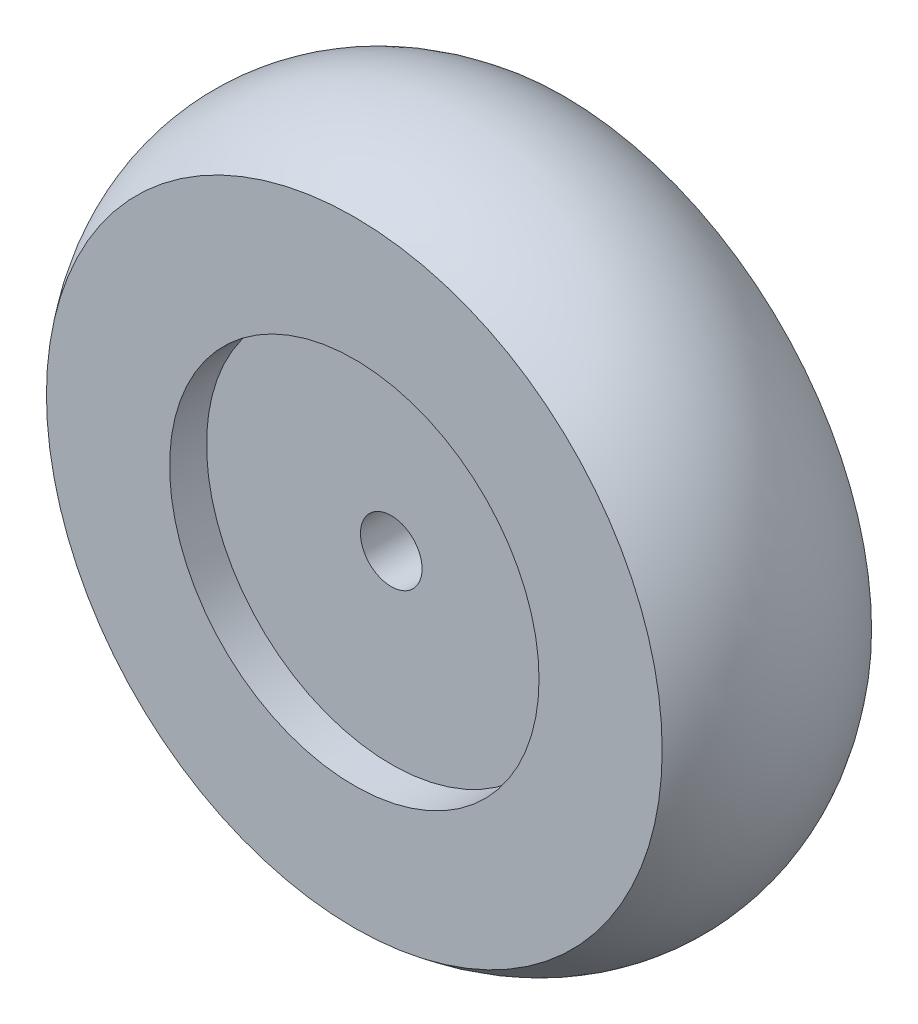
from build123d import *

# Parameters (mm, degrees)
SKETCH_1_R          = 25
EXTRUDE_1_DEPTH     = 17
SKETCH_4_R          = 15
CUT_EXTRUDE_1_DEPTH = 3
CUT_EXTRUDE_START   = -3
SKETCH_5_R          = 15
CUT_EXTRUDE_2_DEPTH = 3
CUT_EXTRUDE_3_REACH = 44.052
SKETCH_6_R          = 2.5


with BuildPart() as part:
    # 草图1 → 凸台-拉伸1 (new body)
    with BuildSketch(Plane.XY):
        Circle(SKETCH_1_R)
    extrude(amount=EXTRUDE_1_DEPTH)

    # 扫描1: sweep along a curve in space
    with BuildLine() as sweep_1_path:
        ThreePointArc((25, 0, 17), (17.67766953, 17.67766953, 17), (0, 25, 17))
        ThreePointArc((0, 25, 17), (-17.67766953, 17.67766953, 17), (-25, 0, 17))
        ThreePointArc((-25, 0, 17), (-17.67766953, -17.67766953, 17), (0, -25, 17))
        ThreePointArc((0, -25, 17), (17.67766953, -17.67766953, 17), (25, 0, 17))
    # 草图3 → 扫描1 (sweep)
    with BuildSketch(Plane(origin=(0, 0, 0), x_dir=(1, 0, 0), z_dir=(0, 1, 0))):
        with BuildLine():
            Line((25, -17), (25, 0))
            ThreePointArc((25, 0), (28.038998363, -8.5), (25, -17))
        make_face()
    sweep(path=sweep_1_path.line)

    # 草图4 → 切除-拉伸1 (cut)
    with BuildSketch(Plane(origin=(0, 0, 0), x_dir=(-1, 0, 0), z_dir=(0, 0, -1))):
        Circle(SKETCH_4_R)
    extrude(amount=-CUT_EXTRUDE_1_DEPTH, mode=Mode.SUBTRACT)

    # 草图5 → 切除-拉伸2 (cut)
    with BuildSketch(Plane.XY.offset(17).offset(CUT_EXTRUDE_START)):
        with Locations(Location((0, 0, 0), (0, 0, 180))):
            Circle(SKETCH_5_R)
    extrude(amount=CUT_EXTRUDE_2_DEPTH, mode=Mode.SUBTRACT)

    # 草图6 → 切除-拉伸3 (cut, up to next)
    with BuildSketch(Plane(origin=(0, 0, 3), x_dir=(-1, 0, 0), z_dir=(0, 0, -1)), mode=Mode.PRIVATE) as cut_extrude_3_sk1:
        Circle(SKETCH_6_R)
    cut_extrude_3_tool1 = extrude(cut_extrude_3_sk1.sketch, amount=-CUT_EXTRUDE_3_REACH, mode=Mode.PRIVATE) & part.part
    add(cut_extrude_3_tool1.solids().sort_by_distance((0, 0, 3))[0], mode=Mode.SUBTRACT)


solid = part.part
